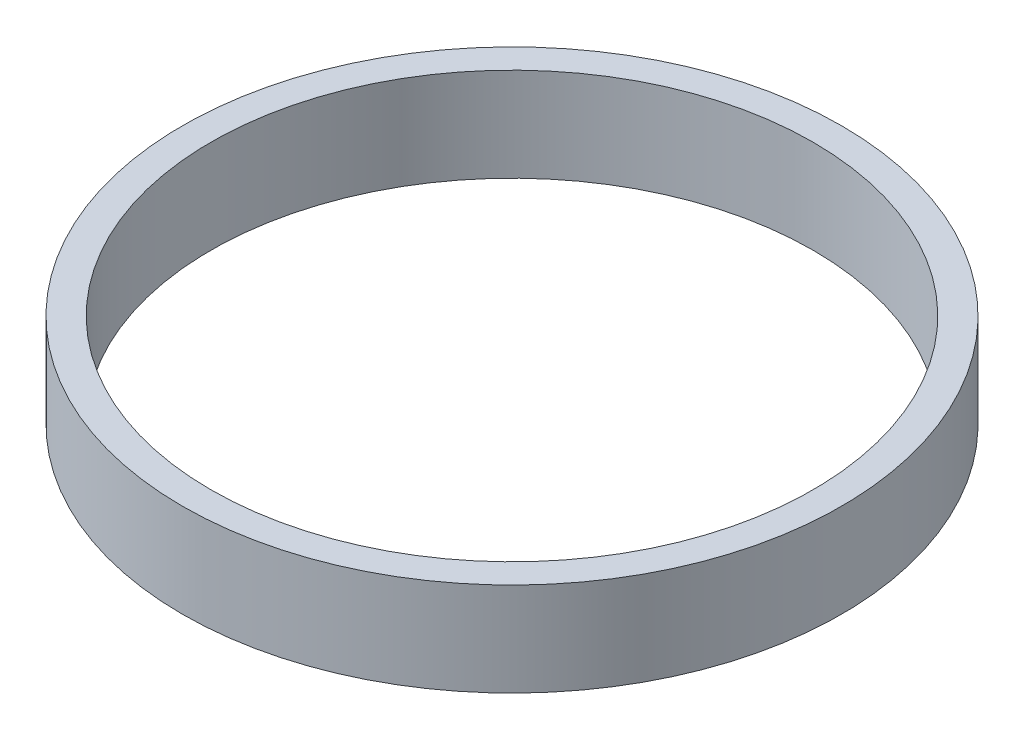
from build123d import *

# Parameters (mm, degrees)
YUVA_ICECEK_HALKA_1_START = 6.5
SKETCH1_R                 = 40.5
YUVA_ICECEK_HALKA_1_DEPTH = 11.5
YUVA_ICECEK_HALKA_2_START = 6
SKETCH2_R                 = 37
YUVA_ICECEK_HALKA_2_DEPTH = 13


with BuildPart() as part:
    # Sketch1 → YUVA_icecek_halka_1 (new body)
    with BuildSketch(Plane(origin=(0, 0, 0), x_dir=(1, 0, 0), z_dir=(0, 1, 0)).offset(YUVA_ICECEK_HALKA_1_START)):
        with Locations(Location((0, 0, 0), (0, 0, 270))):
            Circle(SKETCH1_R)
    extrude(amount=YUVA_ICECEK_HALKA_1_DEPTH)

    # Sketch2 → YUVA_icecek_halka_2 (cut)
    with BuildSketch(Plane(origin=(0, 0, 0), x_dir=(1, 0, 0), z_dir=(0, 1, 0)).offset(YUVA_ICECEK_HALKA_2_START)):
        with Locations(Location((0, 0, 0), (0, 0, 270))):
            Circle(SKETCH2_R)
    extrude(amount=YUVA_ICECEK_HALKA_2_DEPTH, mode=Mode.SUBTRACT)


solid = part.part
